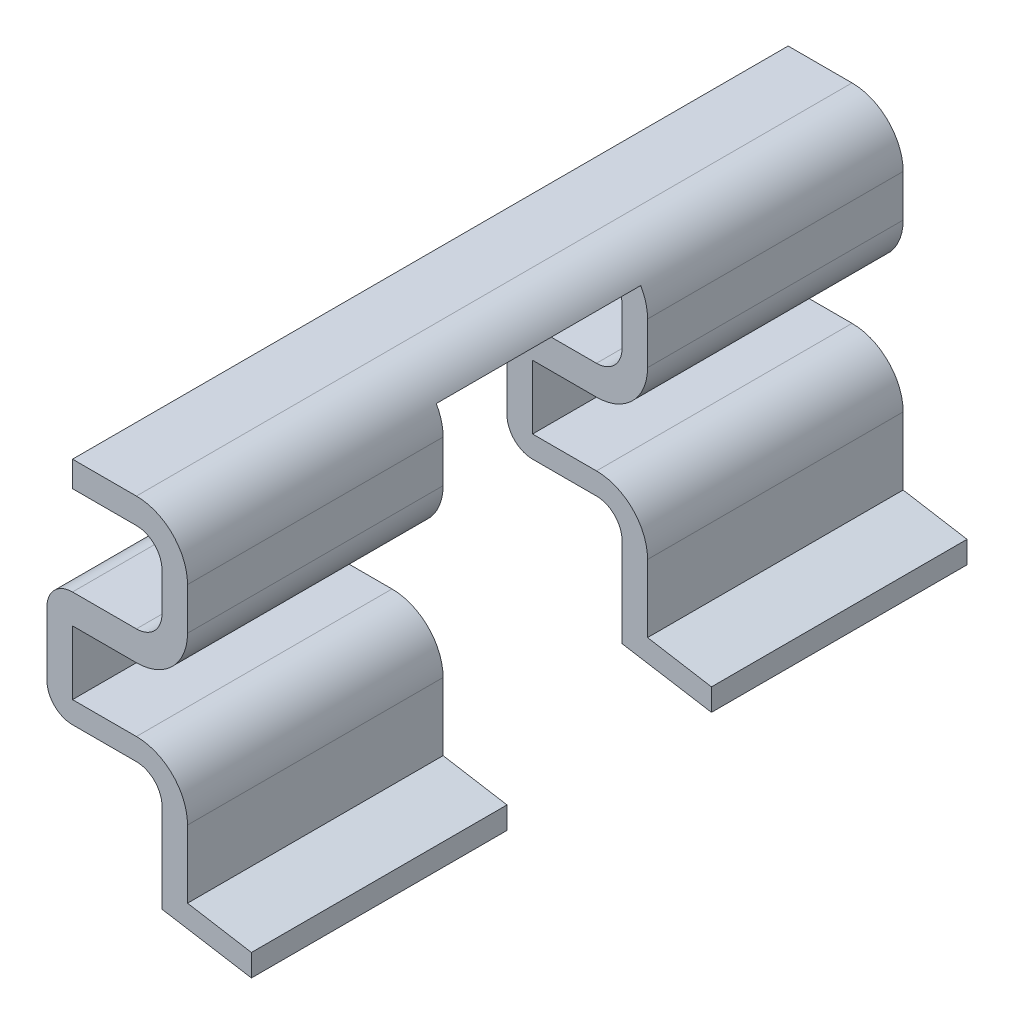
from build123d import *

# Parameters (mm, degrees)
BOSS_EXTRUDE1_DEPTH = 56
SKETCH3_W           = 16
SKETCH3_H           = 28
CUT_EXTRUDE1_DEPTH  = 61.057795506


with BuildPart() as part:
    # Sketch2 → Boss-Extrude1 (new body)
    with BuildSketch(Plane.XY):
        with BuildLine():
            ThreePointArc((-52.370168415, 4.5), (-50.955954852, 5.085786438), (-50.370168415, 6.5))
            Line((-50.370168415, 6.5), (-50.370168415, 9.5))
            ThreePointArc((-50.370168415, 9.5), (-50.955954852, 10.914213562), (-52.370168415, 11.5))
            Line((-52.370168415, 11.5), (-57.370168415, 11.5))
            Line((-57.370168415, 11.5), (-57.370168415, 13.5))
            Line((-57.370168415, 13.5), (-52.370168415, 13.5))
            ThreePointArc((-52.370168415, 13.5), (-49.54174129, 12.328427125), (-48.370168415, 9.5))
            Line((-48.370168415, 9.5), (-48.370168415, 6.204424851))
            ThreePointArc((-48.370168415, 6.204424851), (-49.54174129, 3.375997726), (-52.370168415, 2.204424851))
            Line((-52.370168415, 2.204424851), (-57.370168415, 2.204424851))
            Line((-57.370168415, 2.204424851), (-57.370168415, -2.795575149))
            Line((-57.370168415, -2.795575149), (-52.370168415, -2.795575149))
            ThreePointArc((-52.370168415, -2.795575149), (-49.54174129, -3.967148025), (-48.370168415, -6.795575149))
            Line((-48.370168415, -6.795575149), (-48.370168415, -12.091150299))
            Line((-48.370168415, -12.091150299), (-43.370168415, -12.93073765))
            Line((-43.370168415, -12.93073765), (-43.370168415, -14.660791284))
            Line((-43.370168415, -14.660791284), (-50.370168415, -13.5))
            Line((-50.370168415, -13.5), (-50.370168415, -6.5))
            ThreePointArc((-50.370168415, -6.5), (-50.955954852, -5.085786438), (-52.370168415, -4.5))
            Line((-52.370168415, -4.5), (-57.370168415, -4.5))
            ThreePointArc((-57.370168415, -4.5), (-58.784381977, -3.914213562), (-59.370168415, -2.5))
            Line((-59.370168415, -2.5), (-59.370168415, 2.5))
            ThreePointArc((-59.370168415, 2.5), (-58.784381977, 3.914213562), (-57.370168415, 4.5))
            Line((-57.370168415, 4.5), (-52.370168415, 4.5))
        make_face()
    extrude(amount=BOSS_EXTRUDE1_DEPTH)

    # Sketch3 → Cut-Extrude1 (cut, through all)
    with BuildSketch(Plane.ZY.offset(59.370168415)):
        with Locations((28, -2.5)):
            Rectangle(SKETCH3_W, SKETCH3_H)
    extrude(amount=-CUT_EXTRUDE1_DEPTH, mode=Mode.SUBTRACT)


solid = part.part
